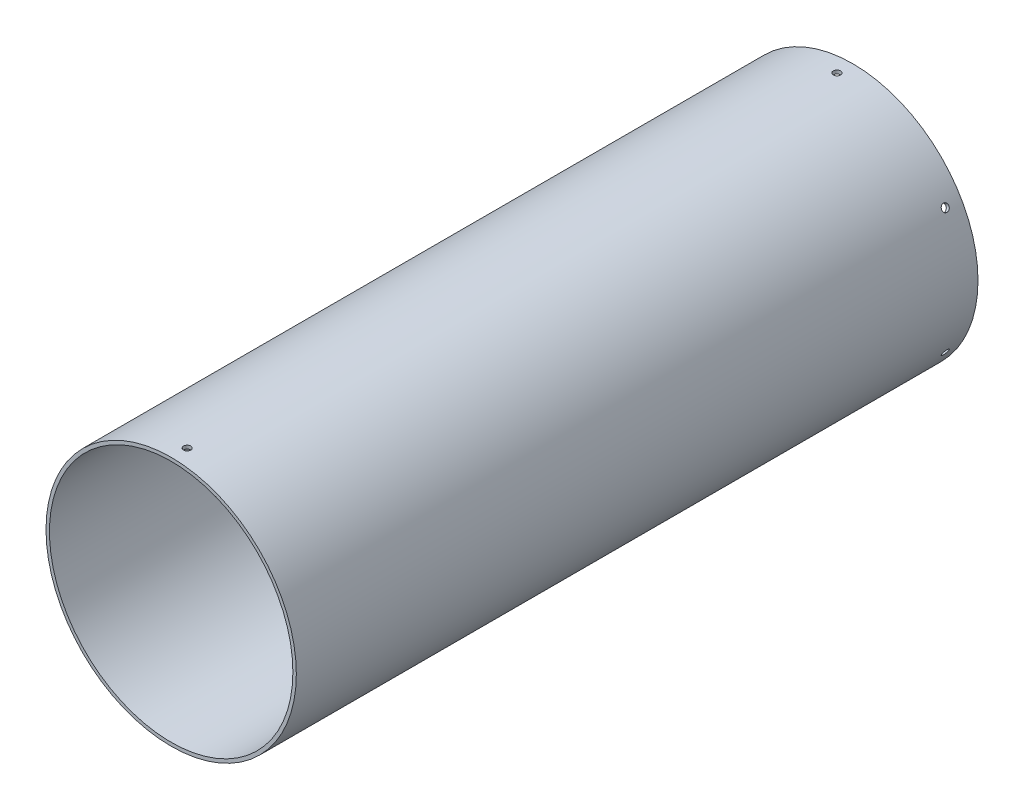
from build123d import *

# Parameters (mm, degrees)
SKETCH1_R           = 78.359
SKETCH1_R_2         = 76.2
BOSS_EXTRUDE1_DEPTH = 426.75
SKETCH5_W           = 2.25
SKETCH5_H           = 78.359
CIRPATTERN1_COUNT   = 6
SKETCH7_W           = 2.25
SKETCH7_H           = 78.359


with BuildPart() as part:
    # Sketch1 → Boss-Extrude1 (new body)
    with BuildSketch(Plane.XY):
        Circle(SKETCH1_R)
        Circle(SKETCH1_R_2, mode=Mode.SUBTRACT)
    extrude(amount=BOSS_EXTRUDE1_DEPTH)

    # Sketch5 → M4 Clearance Hole2 (revolve, cut)
    with BuildSketch(Plane(origin=(0, 0, 10), x_dir=(0, 0, 1), z_dir=(1, 0, 0))):
        with Locations((1.125, 39.1795)):
            Rectangle(SKETCH5_W, SKETCH5_H)
    m4_clearance_hole2 = revolve(axis=Axis((0, 6.35, 10), (0, -1, 0)), mode=Mode.SUBTRACT)

    # CirPattern1: M4 Clearance Hole2 ×6 about axis
    cirpattern1_axis = Axis((0, 0, 426.75), (0, 0, -1))
    for i in range(1, CIRPATTERN1_COUNT):
        add(m4_clearance_hole2.rotate(cirpattern1_axis, i * 360 / CIRPATTERN1_COUNT), mode=Mode.SUBTRACT)

    # Sketch7 → M4 Clearance Hole3 (revolve, cut)
    with BuildSketch(Plane(origin=(0, 0, 416.75), x_dir=(0, 0, -1), z_dir=(1, 0, 0))):
        with Locations((1.125, 39.1795)):
            Rectangle(SKETCH7_W, SKETCH7_H)
    revolve(axis=Axis((0, -6.35, 416.75), (0, 1, 0)), mode=Mode.SUBTRACT)


solid = part.part
